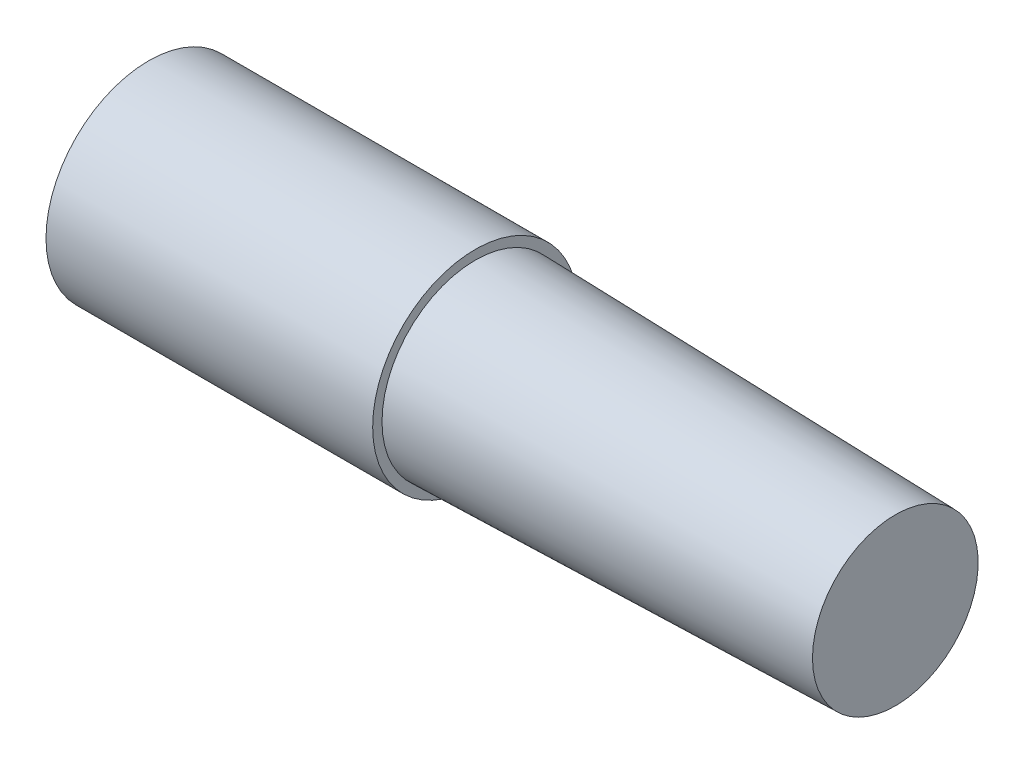
from build123d import *


with BuildPart() as part:
    # Sketch1 → Revolve1 (revolve)
    with BuildSketch(Plane.XY, mode=Mode.PRIVATE) as revolve1_sk:
        Polygon((0, 11), (35, 11), (35, 10), (80, 8.875), (80, 0), (0, 0), (-6.350852961, 0), align=None)
    revolve(revolve1_sk.sketch.rotate(Axis((0, 0, 0), (1, 0, 0)), 90), axis=Axis((0, 0, 0), (1, 0, 0)))


solid = part.part
